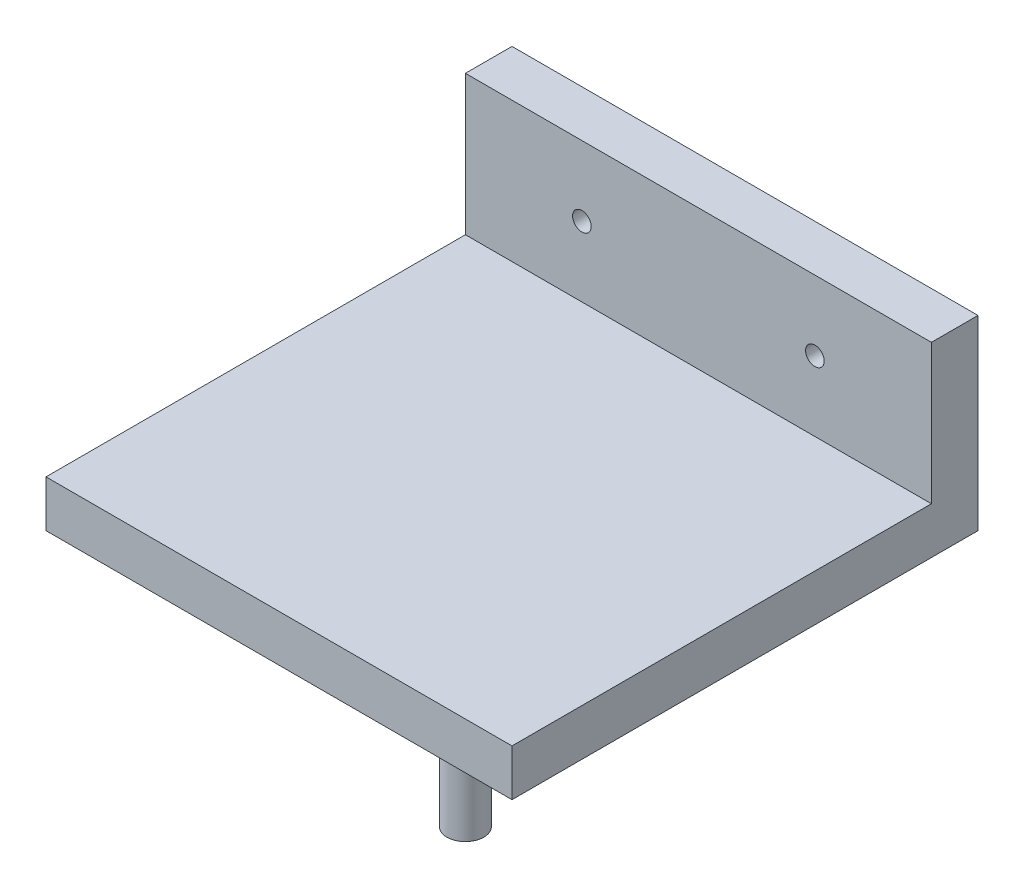
from build123d import *

# Parameters (mm, degrees)
SKETCH1_W           = 100
SKETCH1_H           = 40
BOSS_EXTRUDE1_DEPTH = 10
SKETCH2_W           = 100
SKETCH2_H           = 10
BOSS_EXTRUDE2_DEPTH = 90
SKETCH3_R           = 3.95
BOSS_EXTRUDE3_DEPTH = 50
SKETCH4_R           = 2
CUT_EXTRUDE1_DEPTH  = 50


with BuildPart() as part:
    # Sketch1 → Boss-Extrude1 (new body)
    with BuildSketch(Plane.XY):
        Rectangle(SKETCH1_W, SKETCH1_H)
    extrude(amount=BOSS_EXTRUDE1_DEPTH)

    # Sketch2 → Boss-Extrude2 (add)
    with BuildSketch(Plane.XY.offset(10)):
        with Locations((0, -15)):
            Rectangle(SKETCH2_W, SKETCH2_H)
    extrude(amount=BOSS_EXTRUDE2_DEPTH)

    # Sketch3 → Boss-Extrude3 (add)
    with BuildSketch(Plane.XZ.offset(20)):
        with Locations(Location((0, 60, 0), (0, 0, 90))):
            Circle(SKETCH3_R)
    extrude(amount=BOSS_EXTRUDE3_DEPTH)

    # Sketch4 → Cut-Extrude1 (cut)
    with BuildSketch(Plane.XY.offset(10)):
        with Locations((-25, 5)):
            Circle(SKETCH4_R)
        with Locations((25, 5)):
            Circle(SKETCH4_R)
    extrude(amount=-CUT_EXTRUDE1_DEPTH, mode=Mode.SUBTRACT)


solid = part.part
